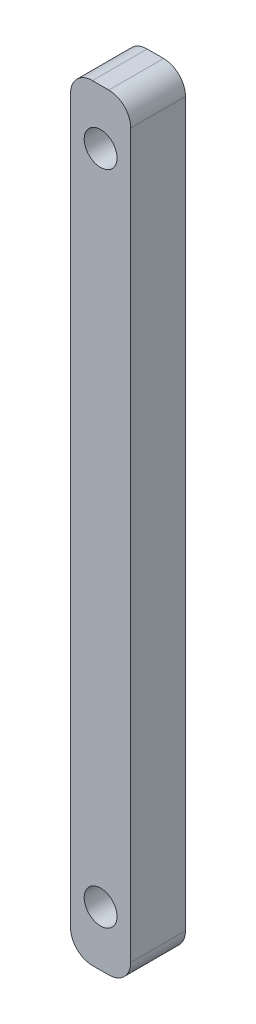
from build123d import *

# Parameters (mm, degrees)
SKETCH_1_W          = 5.5
SKETCH_1_H          = 70
EXTRUDE_1_DEPTH     = 5
SKETCH_2_R          = 1.5
CUT_EXTRUDE_1_DEPTH = 36.462127686
FILLET_1_R          = 2


with BuildPart() as part:
    # 草图1 → 凸台-拉伸1 (new body)
    with BuildSketch(Plane.XY):
        Rectangle(SKETCH_1_W, SKETCH_1_H)
    extrude(amount=EXTRUDE_1_DEPTH)

    # 草图2 → 切除-拉伸1 (cut, through all)
    with BuildSketch(Plane.XY.offset(5)):
        with Locations((0, 30)):
            Circle(SKETCH_2_R)
        with Locations((0, -30)):
            Circle(SKETCH_2_R)
    extrude(amount=-CUT_EXTRUDE_1_DEPTH, mode=Mode.SUBTRACT)

    # 圆角1
    fillet_1_edges = [part.edges().sort_by_distance(p)[0] for p in [
        (-2.75, 35, 2.5),
        (2.75, 35, 2.5),
        (2.75, -35, 2.5),
        (-2.75, -35, 2.5),
    ]]
    fillet(fillet_1_edges, radius=FILLET_1_R)


solid = part.part
